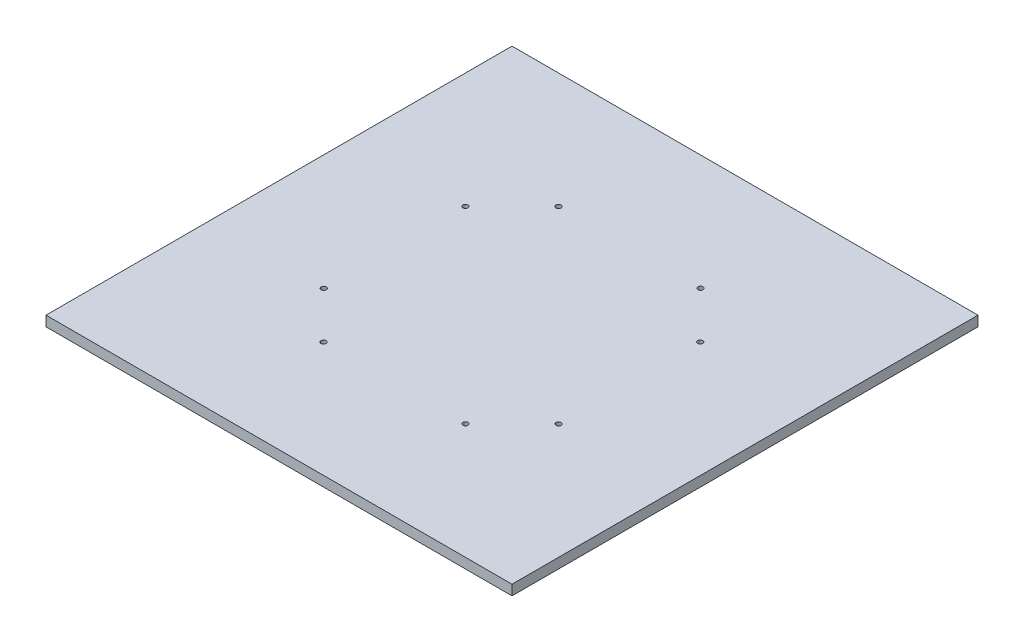
from build123d import *

# Parameters (mm, degrees)
SKETCH1_W           = 292.1
SKETCH1_H           = 292.1
BOSS_EXTRUDE1_DEPTH = 6.35
SKETCH2_R           = 1.599999975
CUT_EXTRUDE1_DEPTH  = 207.64347921
CIRPATTERN1_COUNT   = 4


with BuildPart() as part:
    # Sketch1 → Boss-Extrude1 (new body)
    with BuildSketch(Plane(origin=(0, 0, 0), x_dir=(1, 0, 0), z_dir=(0, 1, 0))):
        Rectangle(SKETCH1_W, SKETCH1_H)
    extrude(amount=BOSS_EXTRUDE1_DEPTH)

    # Sketch2 → Cut-Extrude1 (cut, through all)
    with BuildSketch(Plane(origin=(0, 6.35, 0), x_dir=(1, 0, 0), z_dir=(0, 1, 0))):
        with Locations((73.66, -44.45)):
            Circle(SKETCH2_R)
        with Locations((44.43000004, -73.569999926)):
            Circle(SKETCH2_R)
    cut_extrude1 = extrude(amount=-CUT_EXTRUDE1_DEPTH, mode=Mode.SUBTRACT)

    # CirPattern1: Cut-Extrude1 ×4 about axis
    cirpattern1_axis = Axis((0, 6.35, 0), (0, 1, 0))
    for i in range(1, CIRPATTERN1_COUNT):
        add(cut_extrude1.rotate(cirpattern1_axis, i * 360 / CIRPATTERN1_COUNT), mode=Mode.SUBTRACT)


solid = part.part
